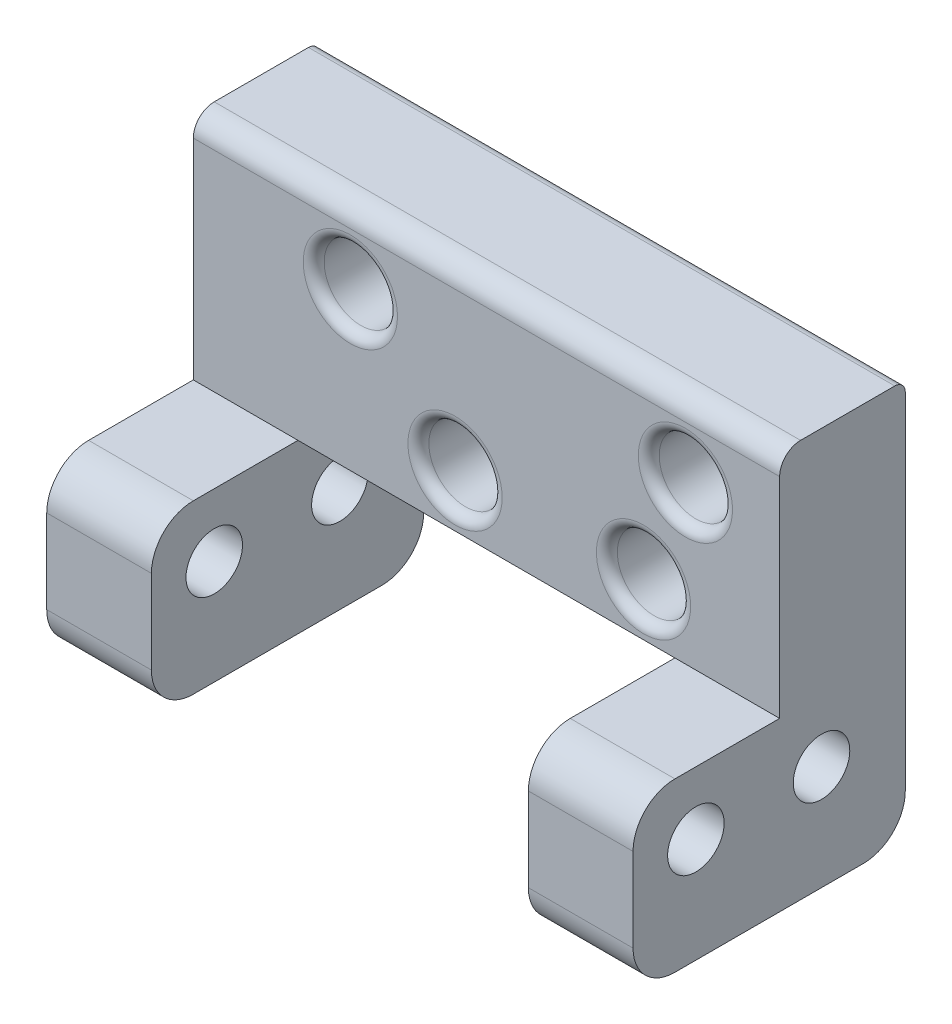
from build123d import *

# Parameters (mm, degrees)
EXTRUDE_1_DEPTH     = 6
SKETCH_3_W          = 7
SKETCH_3_H          = 8
EXTRUDE_2_DEPTH     = 5
SKETCH_2_R          = 1.35
CUT_EXTRUDE_2_DEPTH = 10
SKETCH_6_W          = 13
SKETCH_6_H          = 8
EXTRUDE_3_DEPTH     = 5
SKETCH_8_R          = 1.75
CUT_EXTRUDE_3_DEPTH = 10
FILLET_1_R          = 1
FILLET_2_R          = 0.5
FILLET_3_R          = 2


with BuildPart() as part:
    # 草图1 → 凸台-拉伸1 (new body)
    with BuildSketch(Plane.XY):
        Polygon((14, 11), (-14, 11), (-14, -8), (-9, -8), (-9, 0), (9, 0), (9, -8), (14, -8), align=None)
    extrude(amount=EXTRUDE_1_DEPTH)

    # 草图3 → 凸台-拉伸2 (add)
    with BuildSketch(Plane(origin=(14, 0, 0), x_dir=(0, 0, -1), z_dir=(1, 0, 0))):
        with Locations((-9.5, -4)):
            Rectangle(SKETCH_3_W, SKETCH_3_H)
    extrude(amount=-EXTRUDE_2_DEPTH)

    # 草图2 → 切除-拉伸2 (cut)
    with BuildSketch(Plane(origin=(14, 0, 0), x_dir=(0, 0, -1), z_dir=(1, 0, 0))):
        with Locations(Location((-4, -3, 0), (0, 0, 90))):
            Circle(SKETCH_2_R)
        with Locations(Location((-10, -3, 0), (0, 0, 90))):
            Circle(SKETCH_2_R)
    cut_extrude_2 = extrude(amount=-CUT_EXTRUDE_2_DEPTH, mode=Mode.SUBTRACT)

    # 草图6 → 凸台-拉伸3 (add)
    with BuildSketch(Plane.ZY.offset(14)):
        with Locations((6.5, -4)):
            Rectangle(SKETCH_6_W, SKETCH_6_H)
    extrude(amount=-EXTRUDE_3_DEPTH)

    # 镜向4: 切除-拉伸2 across plane
    add(cut_extrude_2.mirror(Plane(origin=(0, 0, 0), x_dir=(0, 0, 1), z_dir=(1, 0, 0))), mode=Mode.SUBTRACT)

    # 草图8 → 切除-拉伸3 (cut)
    with BuildSketch(Plane(origin=(0, 0, 0), x_dir=(-1, 0, 0), z_dir=(0, 0, -1))):
        with Locations((-9.5, 7.5)):
            Circle(SKETCH_8_R)
        with Locations((-7.5, 2.5)):
            Circle(SKETCH_8_R)
        with Locations(Location((1.5, 2.5, 0), (0, 0, 180))):
            Circle(SKETCH_8_R)
        with Locations(Location((6.5, 7.5, 0), (0, 0, 180))):
            Circle(SKETCH_8_R)
    extrude(amount=-CUT_EXTRUDE_3_DEPTH, mode=Mode.SUBTRACT)

    # 圆角1
    fillet_1_edges = [part.edges().sort_by_distance(p)[0] for p in [
        (0, 11, 6),
    ]]
    fillet(fillet_1_edges, radius=FILLET_1_R)

    # 圆角2
    fillet_2_edges = [part.edges().sort_by_distance(p)[0] for p in [
        (11.25, 7.5, 6),
        (11.25, 7.5, 0),
        (0, 11, 0),
        (9.25, 2.5, 6),
        (9.25, 2.5, 0),
        (-3.25, 2.5, 6),
        (-3.25, 2.5, 0),
        (-8.25, 7.5, 6),
        (-8.25, 7.5, 0),
    ]]
    fillet(fillet_2_edges, radius=FILLET_2_R)

    # 圆角3
    fillet_3_edges = [part.edges().sort_by_distance(p)[0] for p in [
        (-11.5, -8, 0),
        (11.5, -8, 13),
        (11.5, 0, 13),
        (-11.5, 0, 13),
        (-11.5, -8, 13),
        (11.5, -8, 0),
    ]]
    fillet(fillet_3_edges, radius=FILLET_3_R)


solid = part.part
